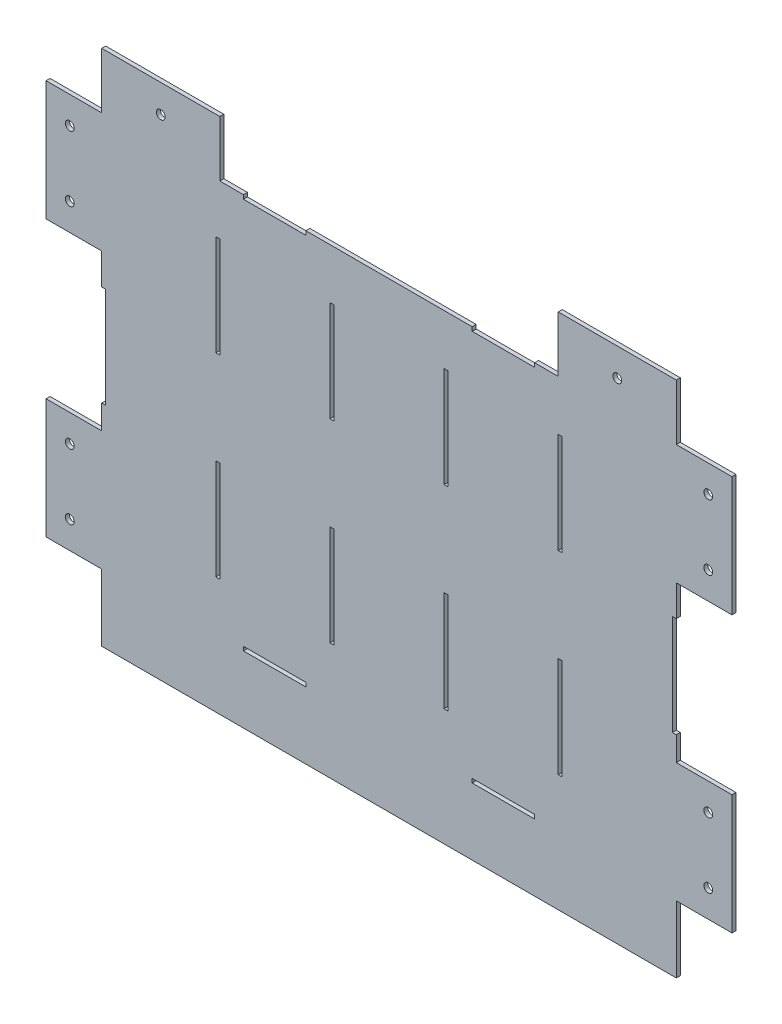
from build123d import *

# Parameters (mm, degrees)
SKETCH1_W                 = 457.223
SKETCH1_H                 = 367.60800004
BOSS_EXTRUDE2_DEPTH       = 3.175
SKETCH4_W                 = 3.175
SKETCH4_H                 = 80
CUT_EXTRUDE1_DEPTH        = 3.175
LPATTERN1_COUNT           = 4
LPATTERN1_PITCH           = 90.807
LPATTERN1_COPY_1_SKETCH_W = 3.175
LPATTERN1_COPY_1_SKETCH_H = 80
LPATTERN1_COPY_1_DEPTH    = 3.175
LPATTERN1_COPY_2_SKETCH_W = 3.175
LPATTERN1_COPY_2_SKETCH_H = 80
LPATTERN1_COPY_2_DEPTH    = 3.175
LPATTERN1_COPY_3_SKETCH_W = 3.175
LPATTERN1_COPY_3_SKETCH_H = 80
LPATTERN1_COPY_3_DEPTH    = 3.175
SKETCH5_W                 = 49.658811606
SKETCH5_H                 = 3.175
CUT_EXTRUDE2_DEPTH        = 3.175
MIRROR3_COPY_1_SKETCH_W   = 49.658811606
MIRROR3_COPY_1_SKETCH_H   = 3.175
MIRROR3_COPY_1_DEPTH      = 3.175
SKETCH6_W                 = 3.175
SKETCH6_H                 = 80
CUT_EXTRUDE3_DEPTH        = 311.705796904
SKETCH8_W                 = 44.275
SKETCH8_H                 = 95.25
SKETCH8_W_2               = 93.98
SKETCH8_H_2               = 44.45
BOSS_EXTRUDE3_DEPTH       = 3.175
M6_CLEARANCE_HOLE1_D      = 7


with BuildPart() as part:
    # Sketch1 → Boss-Extrude2 (new body)
    with BuildSketch(Plane.XY):
        with Locations((0, -26.588)):
            Rectangle(SKETCH1_W, SKETCH1_H)
    extrude(amount=BOSS_EXTRUDE2_DEPTH)

    # Sketch4 → Cut-Extrude1 (cut)
    with BuildSketch(Plane.XY.offset(3.175)):
        with Locations((-136.213, 77.21600002)):
            Rectangle(SKETCH4_W, SKETCH4_H)
    cut_extrude1 = extrude(amount=-CUT_EXTRUDE1_DEPTH, mode=Mode.SUBTRACT)

    # Mirror1: Cut-Extrude1 across plane
    add(cut_extrude1.mirror(Plane.ZX), mode=Mode.SUBTRACT)

    # LPattern1: Cut-Extrude1 ×4
    with Locations(*[(i * LPATTERN1_PITCH, 0, 0) for i in range(1, LPATTERN1_COUNT)]):
        add(cut_extrude1, mode=Mode.SUBTRACT)

    # LPattern1 copy 1 sketch → LPattern1 copy 1 (cut)
    with BuildSketch(Plane(origin=(90.807, 0, 3.175), x_dir=(1, 0, 0), z_dir=(0, 0, 1))):
        with Locations((-136.213, -77.21600002)):
            Rectangle(LPATTERN1_COPY_1_SKETCH_W, LPATTERN1_COPY_1_SKETCH_H)
    extrude(amount=-LPATTERN1_COPY_1_DEPTH, mode=Mode.SUBTRACT)

    # LPattern1 copy 2 sketch → LPattern1 copy 2 (cut)
    with BuildSketch(Plane(origin=(181.614, 0, 3.175), x_dir=(1, 0, 0), z_dir=(0, 0, 1))):
        with Locations((-136.213, -77.21600002)):
            Rectangle(LPATTERN1_COPY_2_SKETCH_W, LPATTERN1_COPY_2_SKETCH_H)
    extrude(amount=-LPATTERN1_COPY_2_DEPTH, mode=Mode.SUBTRACT)

    # LPattern1 copy 3 sketch → LPattern1 copy 3 (cut)
    with BuildSketch(Plane(origin=(272.421, 0, 3.175), x_dir=(1, 0, 0), z_dir=(0, 0, 1))):
        with Locations((-136.213, -77.21600002)):
            Rectangle(LPATTERN1_COPY_3_SKETCH_W, LPATTERN1_COPY_3_SKETCH_H)
    extrude(amount=-LPATTERN1_COPY_3_DEPTH, mode=Mode.SUBTRACT)

    # Sketch5 → Cut-Extrude2 (cut)
    with BuildSketch(Plane.XY.offset(3.175)):
        with Locations((-91.020094169, -155.62850002)):
            Rectangle(SKETCH5_W, SKETCH5_H)
    cut_extrude2 = extrude(amount=-CUT_EXTRUDE2_DEPTH, mode=Mode.SUBTRACT)

    # Mirror2: Cut-Extrude2 across plane
    add(cut_extrude2.mirror(Plane(origin=(0, 0, 0), x_dir=(0, 0, 1), z_dir=(1, 0, 0))), mode=Mode.SUBTRACT)

    # Mirror3: Cut-Extrude2 across plane
    add(cut_extrude2.mirror(Plane.ZX), mode=Mode.SUBTRACT)

    # Mirror3 copy 1 sketch → Mirror3 copy 1 (cut)
    with BuildSketch(Plane(origin=(0, 0, 3.175), x_dir=(-1, 0, 0), z_dir=(0, 0, 1))):
        with Locations((-91.020094169, -155.62850002)):
            Rectangle(MIRROR3_COPY_1_SKETCH_W, MIRROR3_COPY_1_SKETCH_H)
    extrude(amount=-MIRROR3_COPY_1_DEPTH, mode=Mode.SUBTRACT)

    # Sketch6 → Cut-Extrude3 (cut, through all)
    with BuildSketch(Plane.XY.offset(3.175)):
        with Locations((-227.024, -2.78399998)):
            Rectangle(SKETCH6_W, SKETCH6_H)
    cut_extrude3 = extrude(amount=-CUT_EXTRUDE3_DEPTH, mode=Mode.SUBTRACT)

    # Mirror5: Cut-Extrude3 across plane
    add(cut_extrude3.mirror(Plane(origin=(0, 0, 0), x_dir=(0, 0, 1), z_dir=(1, 0, 0))), mode=Mode.SUBTRACT)

    # Sketch8 → Boss-Extrude3 (add)
    with BuildSketch(Plane(origin=(0, 0, 0), x_dir=(-1, 0, 0), z_dir=(0, 0, -1))):
        with Locations((-250.749, 109.59100002)):
            Rectangle(SKETCH8_W, SKETCH8_H)
        with Locations((-181.6215, 179.44100002)):
            Rectangle(SKETCH8_W_2, SKETCH8_H_2)
        with Locations((-250.749, -109.59100002)):
            Rectangle(SKETCH8_W, SKETCH8_H)
    boss_extrude3 = extrude(amount=-BOSS_EXTRUDE3_DEPTH)

    # Mirror7: Boss-Extrude3 across plane
    add(boss_extrude3.mirror(Plane(origin=(0, 0, 0), x_dir=(0, 0, 1), z_dir=(1, 0, 0))))

    # M6 Clearance Hole1 (through all)
    with Locations(Plane(origin=(0, 0, 0), x_dir=(-1, 0, 0), z_dir=(0, 0, -1))):
        with Locations((-254.0115, -135.59100002), (-254.0115, -83.59100002), (-254.0115, 83.59100002), (-254.0115, 135.59100002), (-181.6215, 179.44100002)):
            m6_clearance_hole1 = Hole(M6_CLEARANCE_HOLE1_D / 2)

    # Mirror8: M6 Clearance Hole1 across plane
    add(m6_clearance_hole1.mirror(Plane(origin=(0, 0, 0), x_dir=(0, 0, 1), z_dir=(1, 0, 0))), mode=Mode.SUBTRACT)


solid = part.part
